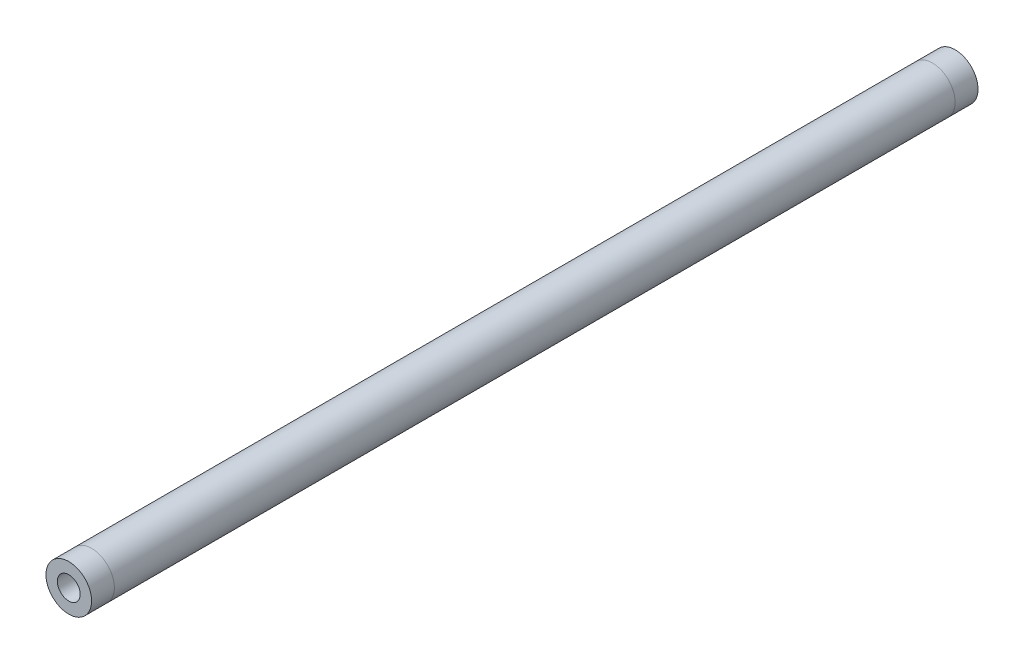
from build123d import *

# Parameters (mm, degrees)
SKETCH1_R                 = 6.35
SKETCH1_R_2               = 5.461
SKETCH1_R_3               = 3.175
THREADED_INSERT_1_1_DEPTH = 6.35
THREADED_START            = -6.35
SKETCH1_3_R               = 5.461
SKETCH1_3_R_2             = 3.175
THREADED_INSERT_1_2_DEPTH = 6.35
TUBE_START                = -6.35
SKETCH1_4_R               = 6.35
SKETCH1_4_R_2             = 5.461
TUBE_EXTRUDE_DEPTH        = 233.99879
THREADED_START_2          = -240.34879
SKETCH1_6_R               = 5.461
SKETCH1_6_R_2             = 3.175
THREADED_INSERT_2_1_DEPTH = 6.35
SKETCH1_9_R               = 6.35
SKETCH1_9_R_2             = 5.461
SKETCH1_9_R_3             = 3.175
THREADED_INSERT_2_2_DEPTH = 6.35


with BuildPart() as part:
    # Sketch1 → Threaded insert 1-1 (new body)
    # profile 1 of 2: a face of its own
    with BuildSketch(Plane.XY):
        Circle(SKETCH1_R)
        Circle(SKETCH1_R_2, mode=Mode.SUBTRACT)
    # profile 2 of 2: a face of its own
    with BuildSketch(Plane.XY):
        Circle(SKETCH1_R_2)
        Circle(SKETCH1_R_3, mode=Mode.SUBTRACT)
    extrude(amount=-THREADED_INSERT_1_1_DEPTH)

    # Sketch1<3> → Threaded insert 1-2 (add)
    with BuildSketch(Plane.XY.offset(THREADED_START)):
        Circle(SKETCH1_3_R)
        Circle(SKETCH1_3_R_2, mode=Mode.SUBTRACT)
    extrude(amount=-THREADED_INSERT_1_2_DEPTH)


with BuildPart() as body_2:
    # Sketch1<4> → Tube extrude (new body)
    with BuildSketch(Plane.XY.offset(TUBE_START)):
        Circle(SKETCH1_4_R)
        Circle(SKETCH1_4_R_2, mode=Mode.SUBTRACT)
    extrude(amount=-TUBE_EXTRUDE_DEPTH)


with BuildPart() as body_3:
    # Sketch1<6> → Threaded insert 2-1 (new body)
    with BuildSketch(Plane.XY.offset(THREADED_START_2)):
        Circle(SKETCH1_6_R)
        Circle(SKETCH1_6_R_2, mode=Mode.SUBTRACT)
    extrude(amount=THREADED_INSERT_2_1_DEPTH)


with BuildPart() as body_4:
    # Sketch1<9> → Threaded insert 2-2 (new body)
    # profile 1 of 2: a face of its own
    with BuildSketch(Plane.XY.offset(THREADED_START_2)):
        Circle(SKETCH1_9_R)
        Circle(SKETCH1_9_R_2, mode=Mode.SUBTRACT)
    # profile 2 of 2: a face of its own
    with BuildSketch(Plane.XY.offset(THREADED_START_2)):
        Circle(SKETCH1_9_R_2)
        Circle(SKETCH1_9_R_3, mode=Mode.SUBTRACT)
    extrude(amount=-THREADED_INSERT_2_2_DEPTH)

    # Combine1: union body 3
    add(body_3.part)


solid = Compound([part.part, body_2.part, body_4.part])
